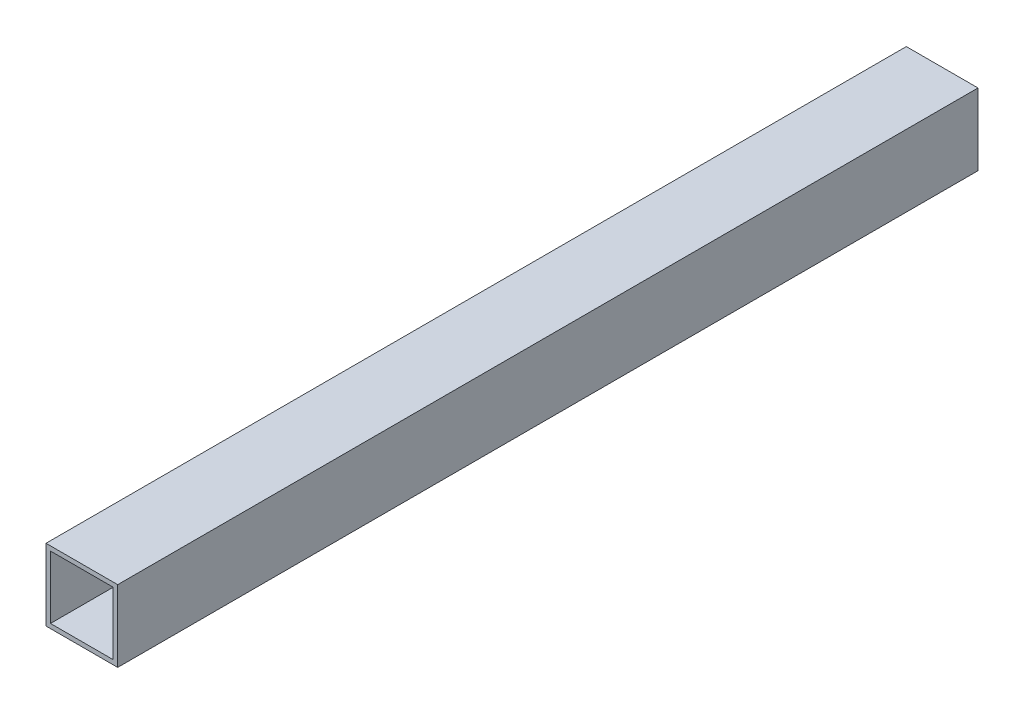
from build123d import *

# Parameters (mm, degrees)
BOSS_EXTRUDE1_DEPTH      = 914.4
BOSS_EXTRUDE1_DEPTH_BACK = 914.4
SKETCH3_W                = 25.4
SKETCH3_H                = 25.4
SKETCH3_W_2              = 22.225
SKETCH3_H_2              = 22.225
SKETCH5_W                = 65.553478052
SKETCH5_H                = 70.136357306
CUT_EXTRUDE1_DEPTH       = 1524


with BuildPart() as part:
    # Sketch3 → Boss-Extrude1 (new, two sides: drawn at the far end of the back side and taken through both)
    with BuildSketch(Plane.XY.offset(-BOSS_EXTRUDE1_DEPTH_BACK)):
        Rectangle(SKETCH3_W, SKETCH3_H)
        Rectangle(SKETCH3_W_2, SKETCH3_H_2, mode=Mode.SUBTRACT)
    extrude(amount=BOSS_EXTRUDE1_DEPTH + BOSS_EXTRUDE1_DEPTH_BACK)

    # Sketch5 → Cut-Extrude1 (cut)
    with BuildSketch(Plane.XY.offset(914.4)):
        Rectangle(SKETCH5_W, SKETCH5_H)
    extrude(amount=-CUT_EXTRUDE1_DEPTH, mode=Mode.SUBTRACT)


solid = part.part
